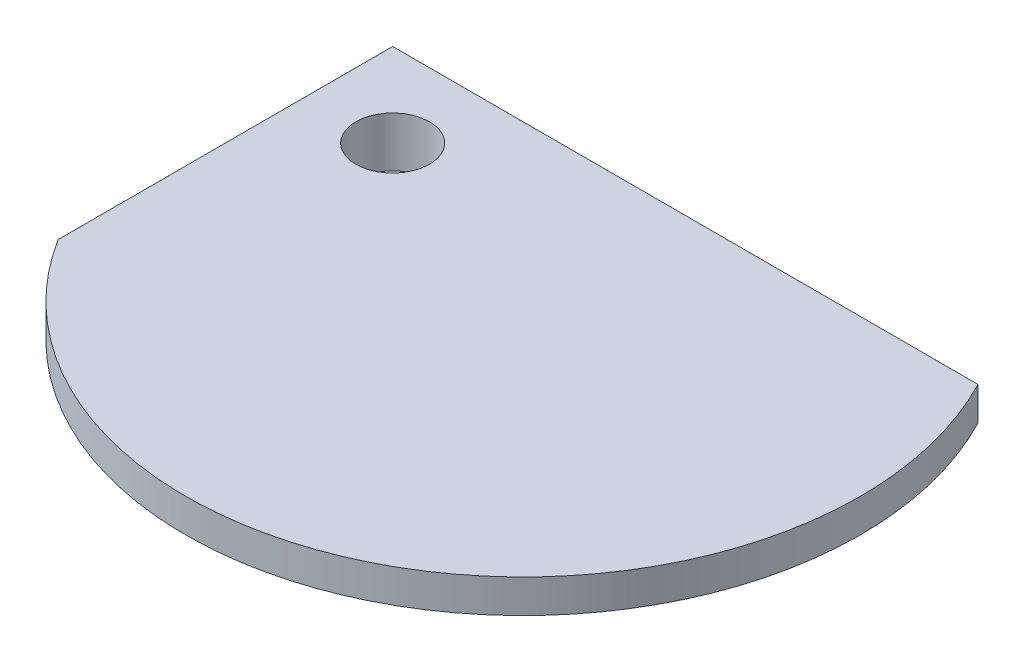
from build123d import *

# Parameters (mm, degrees)
SKETCH1_R           = 4.572
SKETCH1_R_2         = 2.794
BOSS_EXTRUDE1_DEPTH = 3.2004
SKETCH2_R           = 4.572
SKETCH2_R_2         = 1.397
BOSS_EXTRUDE2_DEPTH = 1.778
SKETCH3_R           = 6.35
SKETCH3_R_2         = 2.794
BOSS_EXTRUDE3_DEPTH = 1.27
SKETCH4_R           = 2.794
BOSS_EXTRUDE4_DEPTH = 2.54


with BuildPart() as part:
    # Sketch1 → Boss-Extrude1 (new body)
    with BuildSketch(Plane(origin=(0, 0, 0), x_dir=(1, 0, 0), z_dir=(0, 1, 0))):
        with Locations(Location((0, 0, 0), (0, 0, 270))):
            Circle(SKETCH1_R)
        with Locations(Location((0, 0, 0), (0, 0, 270))):
            Circle(SKETCH1_R_2, mode=Mode.SUBTRACT)
    extrude(amount=BOSS_EXTRUDE1_DEPTH)

    # Sketch2 → Boss-Extrude2 (add)
    with BuildSketch(Plane(origin=(0, 3.2004, 0), x_dir=(1, 0, 0), z_dir=(0, 1, 0))):
        with Locations(Location((0, 0, 0), (0, 0, 270))):
            Circle(SKETCH2_R)
        with Locations(Location((0, 0, 0), (0, 0, 270))):
            Circle(SKETCH2_R_2, mode=Mode.SUBTRACT)
    extrude(amount=BOSS_EXTRUDE2_DEPTH)


with BuildPart() as body_2:
    # Sketch3 → Boss-Extrude3 (new body)
    with BuildSketch(Plane(origin=(0, 4.9784, 0), x_dir=(1, 0, 0), z_dir=(0, 1, 0))):
        with Locations(Location((0, 0, 0), (0, 0, 270))):
            Circle(SKETCH3_R)
        with Locations(Location((0, 0, 0), (0, 0, 270))):
            Circle(SKETCH3_R_2, mode=Mode.SUBTRACT)
    extrude(amount=BOSS_EXTRUDE3_DEPTH)

    # Sketch4 → Boss-Extrude4 (add)
    with BuildSketch(Plane(origin=(0, 6.2484, 0), x_dir=(1, 0, 0), z_dir=(0, 1, 0))):
        with BuildLine():
            Line((-6.35, 6.35), (38.1, 6.35))
            ThreePointArc((38.1, 6.35), (28.085656371, -27.718648649), (-6.35, -19.05))
            Line((-6.35, -19.05), (-6.35, 6.35))
        make_face()
        with Locations(Location((0, 0, 0), (0, 0, 270))):
            Circle(SKETCH4_R, mode=Mode.SUBTRACT)
    extrude(amount=BOSS_EXTRUDE4_DEPTH)


solid = Compound([part.part, body_2.part])
